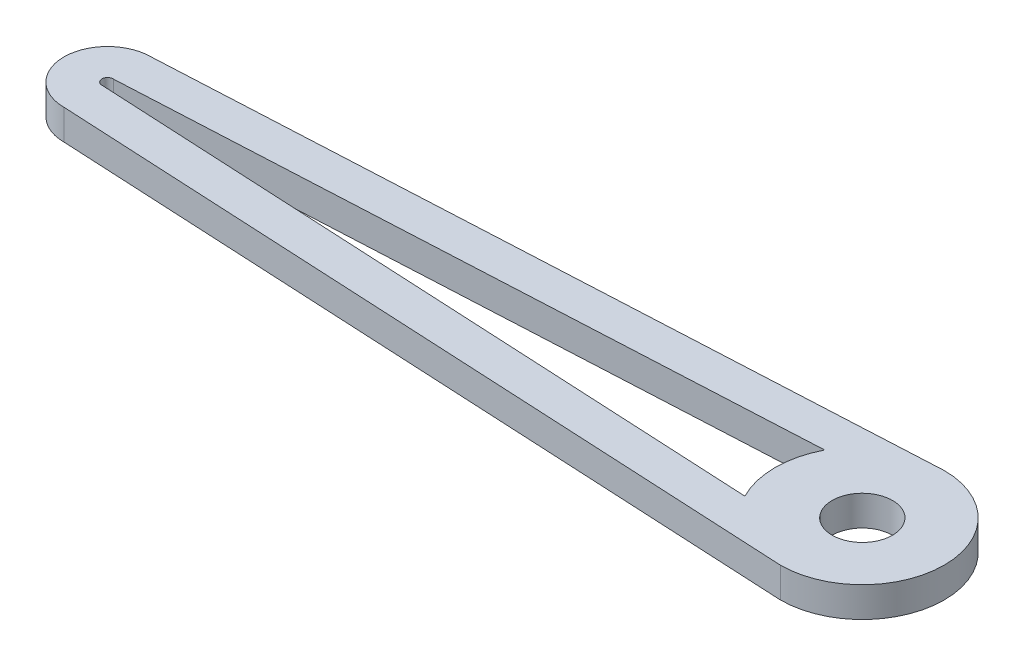
from build123d import *

# Parameters (mm, degrees)
SKETCH1_R           = 1.5875
BOSS_EXTRUDE1_DEPTH = 0.79375


with BuildPart() as part:
    # Sketch1 → Boss-Extrude1 (new, symmetric)
    with BuildSketch(Plane(origin=(0, 0, 0), x_dir=(1, 0, 0), z_dir=(0, 1, 0))):
        with BuildLine():
            Line((-18.707195569, 2.292804431), (21, 4.31097716))
            ThreePointArc((21, 4.31097716), (25.31097716, 0), (21, -4.31097716))
            Line((21, -4.31097716), (-18.707195569, -2.292804431))
            ThreePointArc((-18.707195569, -2.292804431), (-21, 0), (-18.707195569, 2.292804431))
        make_face()
        with Locations(Location((21, 0, 0), (0, 0, 270))):
            Circle(SKETCH1_R, mode=Mode.SUBTRACT)
        with BuildLine():
            Line((-18.680462574, 0.291581518), (16.921956733, 2.101123358))
            ThreePointArc((16.921956733, 2.101123358), (16.4125, 0), (16.921956733, -2.101123358))
            Line((16.921956733, -2.101123358), (-18.680462574, -0.291581518))
            ThreePointArc((-18.680462574, -0.291581518), (-19, 0), (-18.680462574, 0.291581518))
        make_face(mode=Mode.SUBTRACT)
    extrude(amount=BOSS_EXTRUDE1_DEPTH, both=True)


solid = part.part
